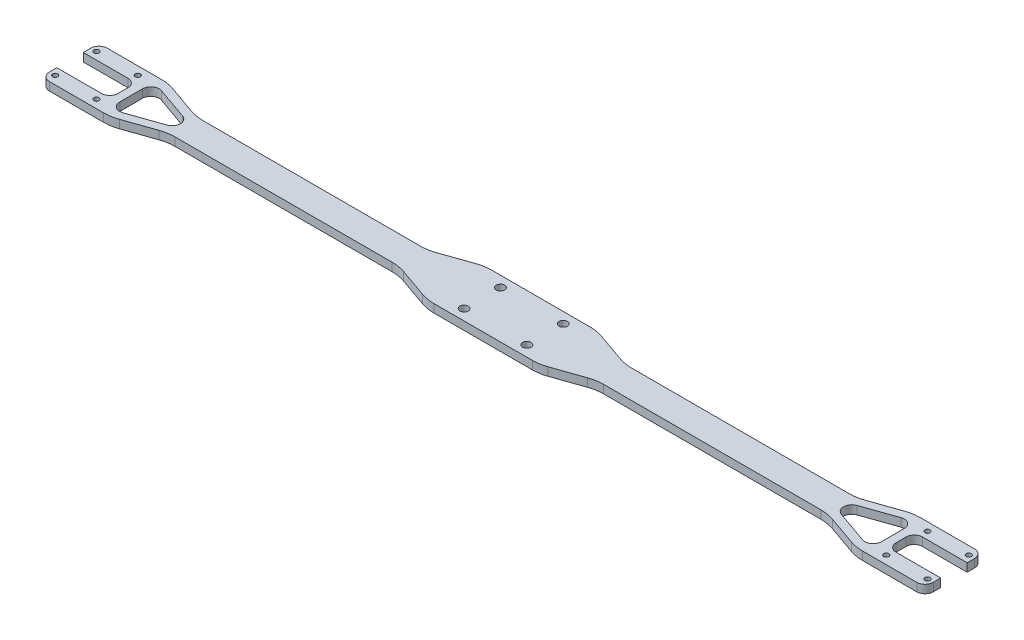
from build123d import *

# Parameters (mm, degrees)
SALIENTE_EXTRUIR1_DEPTH = 5
REDONDEO1_R             = 5
CROQUIS3_R              = 1.55
CROQUIS3_R_2            = 2.55
CORTAR_EXTRUIR1_DEPTH   = 269.118443976
REDONDEO3_R             = 25


with BuildPart() as part:
    # Croquis2 → Saliente-Extruir1 (new body)
    with BuildSketch(Plane(origin=(0, 0, 0), x_dir=(1, 0, 0), z_dir=(0, 1, 0))):
        Polygon((-267.5, 8), (-235.5, 8), (-235.5, -8), (-267.5, -8), (-267.5, -17.5), (-225.5, -17.5), (-199.75, -8.5), (-59.75, -8.5), (-34, -17.5), (34, -17.5), (59.75, -8.5), (199.75, -8.5), (225.5, -17.5), (267.5, -17.5), (267.5, -8), (235.5, -8), (235.5, 8), (267.5, 8), (267.5, 17.5), (225.5, 17.5), (199.75, 8.5), (59.75, 8.5), (34, 17.5), (-34, 17.5), (-59.75, 8.5), (-199.75, 8.5), (-225.5, 17.5), (-267.5, 17.5), align=None)
        with BuildLine():
            Line((-204.02626503, 4.698013204), (-223.850289247, 11.626798368))
            ThreePointArc((-223.850289247, 11.626798368), (-228.394084159, 10.984080534), (-230.5, 6.906792602))
            Line((-230.5, 6.906792602), (-230.5, -6.906792602))
            ThreePointArc((-230.5, -6.906792602), (-228.394084159, -10.984080534), (-223.850289247, -11.626798368))
            Line((-223.850289247, -11.626798368), (-204.02626503, -4.698013204))
            ThreePointArc((-204.02626503, -4.698013204), (-200.737601329, 0), (-204.02626503, 4.698013204))
        make_face(mode=Mode.SUBTRACT)
        with BuildLine():
            Line((204.02626503, 4.698013204), (223.850289247, 11.626798368))
            ThreePointArc((223.850289247, 11.626798368), (228.394084159, 10.984080534), (230.5, 6.906792602))
            Line((230.5, 6.906792602), (230.5, -6.906792602))
            ThreePointArc((230.5, -6.906792602), (228.394084159, -10.984080534), (223.850289247, -11.626798368))
            Line((223.850289247, -11.626798368), (204.02626503, -4.698013204))
            ThreePointArc((204.02626503, -4.698013204), (200.737601329, 0), (204.02626503, 4.698013204))
        make_face(mode=Mode.SUBTRACT)
    extrude(amount=SALIENTE_EXTRUIR1_DEPTH)

    # Redondeo1
    redondeo1_edges = [part.edges().sort_by_distance(p)[0] for p in [
        (235.5, 2.5, -8),
        (235.5, 2.5, 8),
        (267.5, 2.5, 17.5),
        (-267.5, 2.5, 17.5),
        (-235.5, 2.5, 8),
        (-235.5, 2.5, -8),
        (-267.5, 2.5, -17.5),
        (267.5, 2.5, -17.5),
    ]]
    fillet(redondeo1_edges, radius=REDONDEO1_R)

    # Croquis3 → Cortar-Extruir1 (cut, through all)
    with BuildSketch(Plane(origin=(0, 5, 0), x_dir=(1, 0, 0), z_dir=(0, 1, 0))):
        with Locations(Location((-264, -12.5, 0), (0, 0, 270))):
            Circle(CROQUIS3_R)
        with Locations(Location((-239, -12.5, 0), (0, 0, 270))):
            Circle(CROQUIS3_R)
        with Locations(Location((-239, 12.5, 0), (0, 0, 270))):
            Circle(CROQUIS3_R)
        with Locations(Location((-264, 12.5, 0), (0, 0, 270))):
            Circle(CROQUIS3_R)
        with Locations(Location((264, 12.5, 0), (0, 0, 90))):
            Circle(CROQUIS3_R)
        with Locations(Location((239, 12.5, 0), (0, 0, 90))):
            Circle(CROQUIS3_R)
        with Locations(Location((239, -12.5, 0), (0, 0, 90))):
            Circle(CROQUIS3_R)
        with Locations(Location((264, -12.5, 0), (0, 0, 90))):
            Circle(CROQUIS3_R)
        with Locations(Location((-18, -11, 0), (0, 0, 270))):
            Circle(CROQUIS3_R_2)
        with Locations(Location((20, -11, 0), (0, 0, 270))):
            Circle(CROQUIS3_R_2)
        with Locations(Location((20, 11, 0), (0, 0, 270))):
            Circle(CROQUIS3_R_2)
        with Locations(Location((-18, 11, 0), (0, 0, 270))):
            Circle(CROQUIS3_R_2)
    extrude(amount=-CORTAR_EXTRUIR1_DEPTH, mode=Mode.SUBTRACT)

    # Redondeo3
    redondeo3_edges = [part.edges().sort_by_distance(p)[0] for p in [
        (225.5, 2.5, 17.5),
        (199.75, 2.5, 8.5),
        (59.75, 2.5, 8.5),
        (34, 2.5, 17.5),
        (-34, 2.5, 17.5),
        (-59.75, 2.5, 8.5),
        (-199.75, 2.5, 8.5),
        (-225.5, 2.5, 17.5),
        (-225.5, 2.5, -17.5),
        (-199.75, 2.5, -8.5),
        (-59.75, 2.5, -8.5),
        (-34, 2.5, -17.5),
        (34, 2.5, -17.5),
        (59.75, 2.5, -8.5),
        (199.75, 2.5, -8.5),
        (225.5, 2.5, -17.5),
    ]]
    fillet(redondeo3_edges, radius=REDONDEO3_R)


solid = part.part
